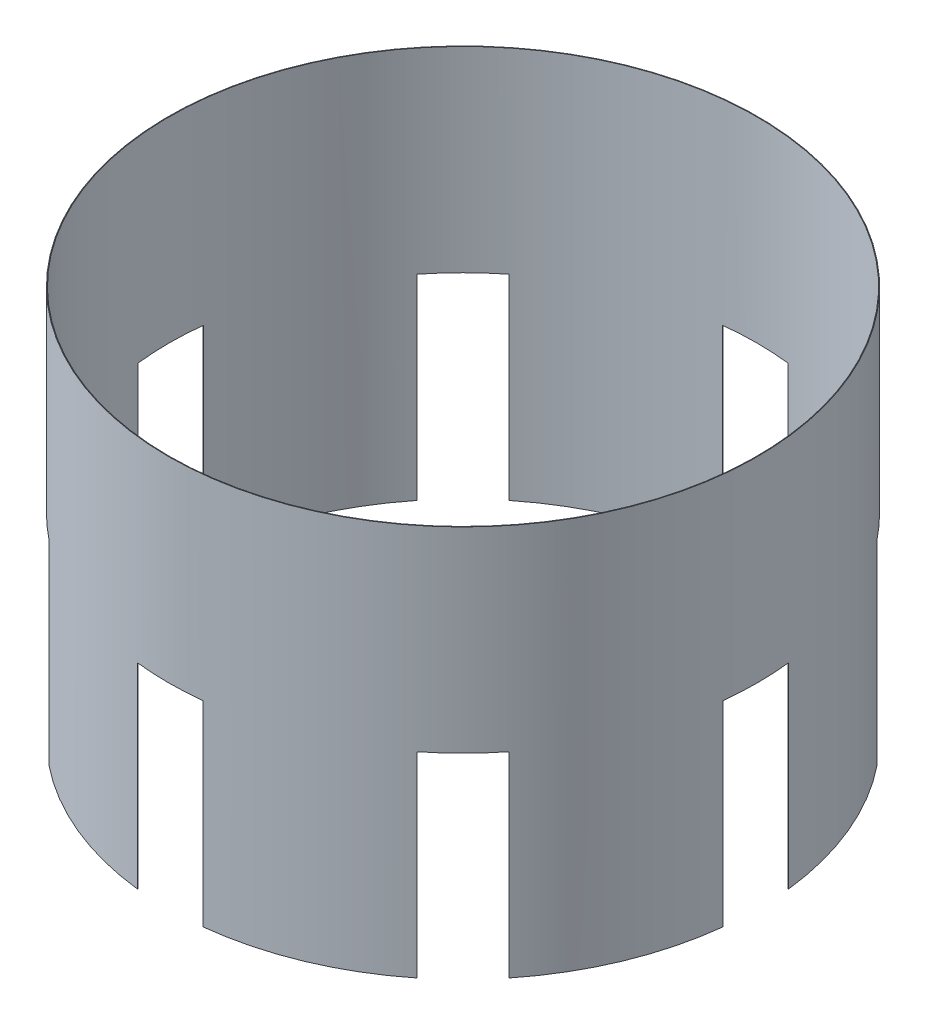
from build123d import *

# Parameters (mm, degrees)
SKETCH1_R           = 451
SKETCH1_R_2         = 450
BOSS_EXTRUDE1_DEPTH = 600
SKETCH10_W          = 100
SKETCH10_H          = 300
CUT_EXTRUDE1_DEPTH  = 1910.660179194
CIRPATTERN1_COUNT   = 4
CIRPATTERN1_ANGLE   = 135


with BuildPart() as part:
    # Sketch1 → Boss-Extrude1 (new body)
    with BuildSketch(Plane(origin=(0, 1200, 0), x_dir=(1, 0, 0), z_dir=(0, 1, 0))):
        Circle(SKETCH1_R)
        Circle(SKETCH1_R_2, mode=Mode.SUBTRACT)
    extrude(amount=BOSS_EXTRUDE1_DEPTH)

    # Sketch10 → Cut-Extrude1 (cut, symmetric)
    with BuildSketch(Plane.XY):
        with Locations((0, 1350)):
            Rectangle(SKETCH10_W, SKETCH10_H)
    cut_extrude1 = extrude(amount=CUT_EXTRUDE1_DEPTH, both=True, mode=Mode.SUBTRACT)

    # CirPattern1: Cut-Extrude1 ×4 about axis
    cirpattern1_axis = Axis((0, 1167.8, 0), (0, 1, 0))
    for i in range(1, CIRPATTERN1_COUNT):
        add(cut_extrude1.rotate(cirpattern1_axis, i * CIRPATTERN1_ANGLE / (CIRPATTERN1_COUNT - 1)), mode=Mode.SUBTRACT)


solid = part.part
